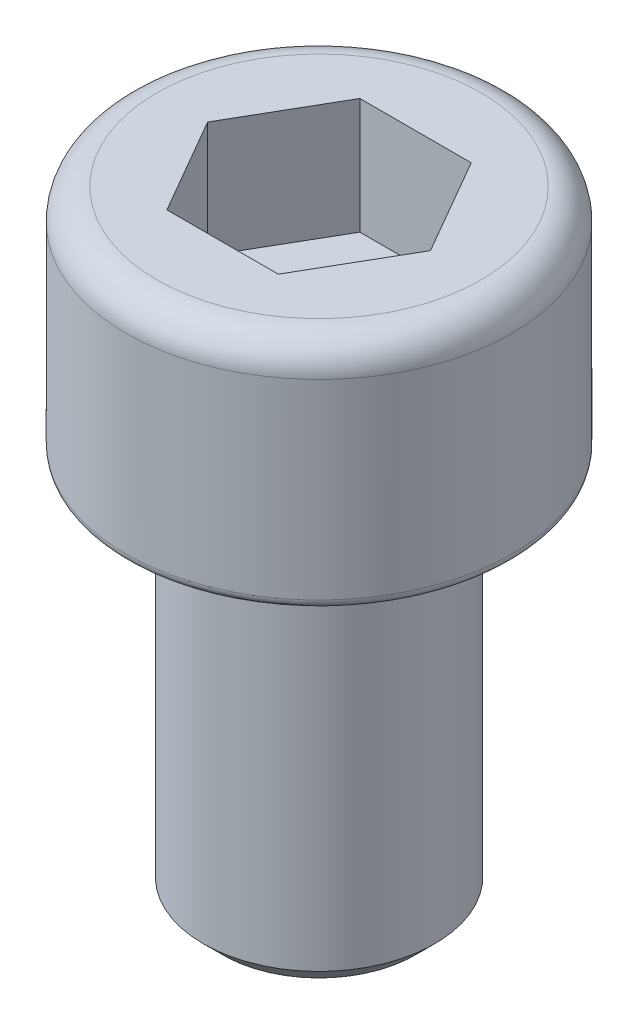
from build123d import *

# Parameters (mm, degrees)
CUT_EXTRUDE1_DEPTH = 3
FILLET3_R          = 0.8
CHAMFER1_SIZE      = 0.5
FILLET4_R          = 0.25


with BuildPart() as part:
    # Sketch1 → Revolve1 (revolve)
    with BuildSketch(Plane.XY, mode=Mode.PRIVATE) as revolve1_sk:
        Polygon((0, 0), (5, 0), (5, -6), (3, -6), (3, -16), (0, -16), align=None)
    revolve(revolve1_sk.sketch.rotate(Axis((0, -21, 0), (0, 1, 0)), 90), axis=Axis((0, -21, 0), (0, 1, 0)))

    # Sketch2 → Cut-Extrude1 (cut)
    with BuildSketch(Plane(origin=(0, 0, 0), x_dir=(1, 0, 0), z_dir=(0, 1, 0))):
        Polygon((2.886751346, 0), (1.443375673, 2.5), (-1.443375673, 2.5), (-2.886751346, 0), (-1.443375673, -2.5), (1.443375673, -2.5), align=None)
    extrude(amount=-CUT_EXTRUDE1_DEPTH, mode=Mode.SUBTRACT)

    # Fillet3
    fillet3_edges = [part.edges().sort_by_distance(p)[0] for p in [
        (0, 0, 5),
    ]]
    fillet(fillet3_edges, radius=FILLET3_R)

    # Chamfer1
    chamfer1_edges = [part.edges().sort_by_distance(p)[0] for p in [
        (0, -16, 3),
    ]]
    chamfer(chamfer1_edges, length=CHAMFER1_SIZE)

    # Fillet4
    fillet4_edges = [part.edges().sort_by_distance(p)[0] for p in [
        (0, -6, 3),
        (0, -6, 5),
    ]]
    fillet(fillet4_edges, radius=FILLET4_R)


solid = part.part
